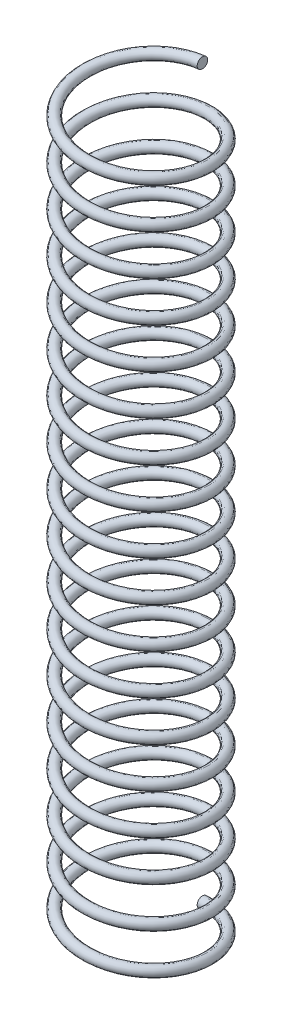
from build123d import *

# Parameters (mm, degrees)
SWEEP1_PITCH       = 4.6
SWEEP1_HEIGHT      = 82.8
SWEEP1_RADIUS      = 7
SWEEP1_START_ANGLE = -180
SKETCH3_R          = 0.6


with BuildPart() as part:
    # Sweep1: sweep along a helix
    with BuildLine() as sweep1_path:
        add(Helix(SWEEP1_PITCH, SWEEP1_HEIGHT, SWEEP1_RADIUS, center=(0, 0, 0), direction=(0, 1, 0), lefthand=True, mode=Mode.PRIVATE).rotate(Axis((0, 0, 0), (0, 1, 0)), SWEEP1_START_ANGLE))
    # Sketch3 → Sweep1 (sweep)
    with BuildSketch(Plane(origin=(0, 0, 0), x_dir=(0, 0, -1), z_dir=(1, 0, 0))):
        with Locations((7, 0)):
            Circle(SKETCH3_R)
    sweep(path=sweep1_path.line, is_frenet=True)


solid = part.part
